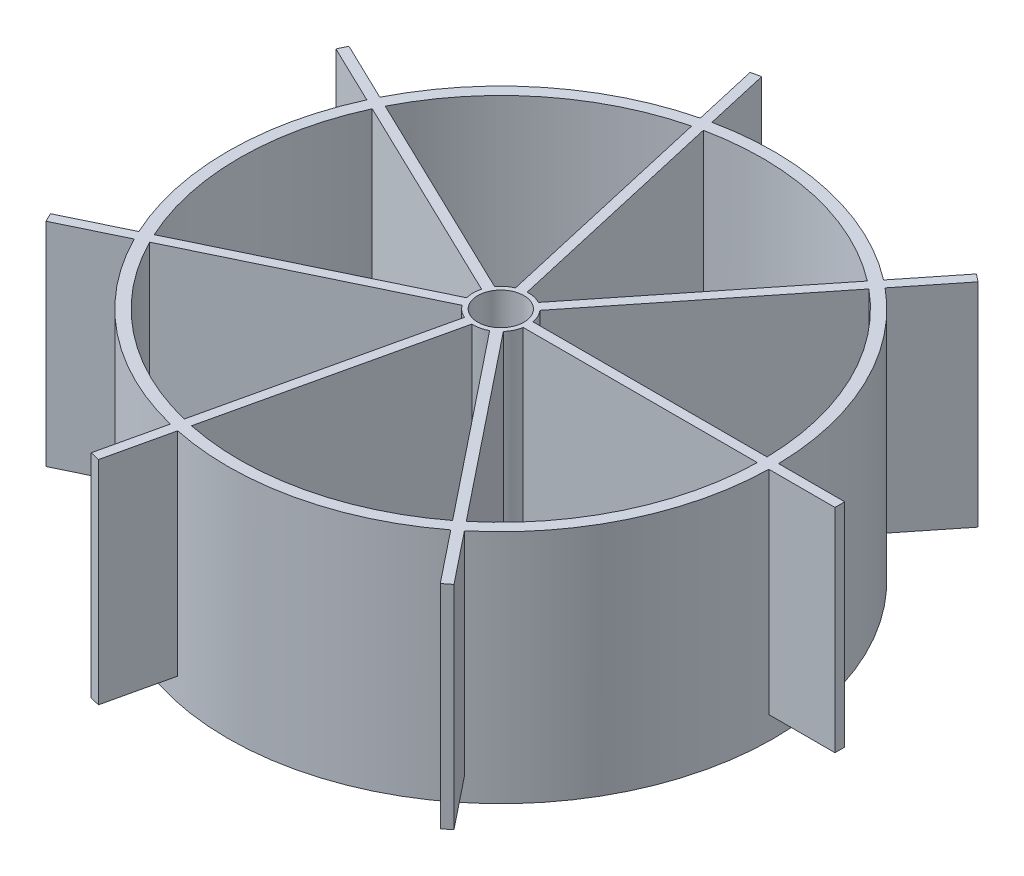
from build123d import *

# Parameters (mm, degrees)
SKETCH1_R           = 113.19870133
BOSS_EXTRUDE1_DEPTH = 10
SKETCH3_R           = 10
BOSS_EXTRUDE2_DEPTH = 92
BOSS_EXTRUDE3_START = -10
SKETCH4_R           = 118.19870133
SKETCH4_R_2         = 113.19870133
BOSS_EXTRUDE3_DEPTH = 102
CUT_EXTRUDE1_START  = -59
CUT_EXTRUDE1_DEPTH  = 59


with BuildPart() as part:
    # Sketch1 → Boss-Extrude1 (new body)
    with BuildSketch(Plane(origin=(0, 0, 0), x_dir=(1, 0, 0), z_dir=(0, 1, 0))):
        with Locations(Location((0, 0, 0), (0, 0, 270))):
            Circle(SKETCH1_R)
    extrude(amount=BOSS_EXTRUDE1_DEPTH)

    # Sketch3 → Boss-Extrude2 (add)
    with BuildSketch(Plane(origin=(0, 10, 0), x_dir=(1, 0, 0), z_dir=(0, 1, 0))):
        with BuildLine():
            Line((11.81310243, 2.10964712), (146.802984355, 2.10964712))
            ThreePointArc((146.802984355, 2.10964712), (146.818142021, 0), (146.802984355, -2.10964712))
            Line((146.802984355, -2.10964712), (11.81310243, -2.10964712))
            ThreePointArc((11.81310243, -2.10964712), (10.811626415, -5.206604869), (9.014737429, -7.920511921))
            Line((9.014737429, -7.920511921), (93.179552163, -113.459851424))
            ThreePointArc((93.179552163, -113.459851424), (91.539614278, -114.78704563), (89.880775093, -116.090538354))
            Line((89.880775093, -116.090538354), (5.715960358, -10.55119885))
            ThreePointArc((5.715960358, -10.55119885), (2.670251207, -11.699134946), (-0.571908724, -11.986363936))
            Line((-0.571908724, -11.986363936), (-30.609983324, -143.591767687))
            ThreePointArc((-30.609983324, -143.591767687), (-32.670110084, -143.137104671), (-34.723491048, -142.652886392))
            Line((-34.723491048, -142.652886392), (-4.685416448, -11.047482641))
            ThreePointArc((-4.685416448, -11.047482641), (-7.481877622, -9.38197779), (-9.727895943, -7.02623943))
            Line((-9.727895943, -7.02623943), (-131.349577039, -65.596154143))
            ThreePointArc((-131.349577039, -65.596154143), (-132.278575204, -63.70200443), (-133.1802602, -61.794701388))
            Line((-133.1802602, -61.794701388), (-11.558579104, -3.224786676))
            ThreePointArc((-11.558579104, -3.224786676), (-12, 0), (-11.558579104, 3.224786676))
            Line((-11.558579104, 3.224786676), (-133.1802602, 61.794701388))
            ThreePointArc((-133.1802602, 61.794701388), (-132.278575204, 63.70200443), (-131.349577039, 65.596154143))
            Line((-131.349577039, 65.596154143), (-9.727895943, 7.02623943))
            ThreePointArc((-9.727895943, 7.02623943), (-7.481877622, 9.38197779), (-4.685416448, 11.047482641))
            Line((-4.685416448, 11.047482641), (-34.723491048, 142.652886392))
            ThreePointArc((-34.723491048, 142.652886392), (-32.670110084, 143.137104671), (-30.609983324, 143.591767687))
            Line((-30.609983324, 143.591767687), (-0.571908724, 11.986363936))
            ThreePointArc((-0.571908724, 11.986363936), (2.670251207, 11.699134946), (5.715960358, 10.55119885))
            Line((5.715960358, 10.55119885), (89.880775093, 116.090538354))
            ThreePointArc((89.880775093, 116.090538354), (91.539614278, 114.78704563), (93.179552163, 113.459851424))
            Line((93.179552163, 113.459851424), (9.014737429, 7.920511921))
            ThreePointArc((9.014737429, 7.920511921), (10.811626415, 5.206604869), (11.81310243, 2.10964712))
        make_face()
        with Locations(Location((0, 0, 0), (0, 0, 270))):
            Circle(SKETCH3_R, mode=Mode.SUBTRACT)
    extrude(amount=BOSS_EXTRUDE2_DEPTH)

    # Sketch4 → Boss-Extrude3 (add)
    with BuildSketch(Plane(origin=(0, 10, 0), x_dir=(1, 0, 0), z_dir=(0, 1, 0)).offset(BOSS_EXTRUDE3_START)):
        with Locations(Location((0, 0, 0), (0, 0, 270))):
            Circle(SKETCH4_R)
        Circle(SKETCH4_R_2, mode=Mode.SUBTRACT)
    extrude(amount=BOSS_EXTRUDE3_DEPTH)

    # Sketch5 → Cut-Extrude1 (cut)
    with BuildSketch(Plane(origin=(0, 10, 0), x_dir=(1, 0, 0), z_dir=(0, 1, 0)).offset(CUT_EXTRUDE1_START)):
        with BuildLine():
            Line((-113.173392965, 2.393555442), (-11.53804838, 2.393555442))
            ThreePointArc((-11.53804838, 2.393555442), (-10.204986578, 5.891851748), (-7.841904008, 8.795465286))
            Line((-7.841904008, 8.795465286), (-58.6595763, 96.814255619))
            ThreePointArc((-58.6595763, 96.814255619), (-98.032951027, 56.599350665), (-113.173392965, 2.393555442))
        make_face()
        with BuildLine():
            Line((-54.513816664, 99.207811061), (-3.696144372, 11.189020728))
            ThreePointArc((-3.696144372, 11.189020728), (0, 11.783703496), (3.696144372, 11.189020728))
            Line((3.696144372, 11.189020728), (54.513816664, 99.207811061))
            ThreePointArc((54.513816664, 99.207811061), (0, 113.19870133), (-54.513816664, 99.207811061))
        make_face()
        with BuildLine():
            Line((-58.6595763, -96.814255619), (-7.841904008, -8.795465286))
            ThreePointArc((-7.841904008, -8.795465286), (-10.204986578, -5.891851748), (-11.53804838, -2.393555442))
            Line((-11.53804838, -2.393555442), (-113.173392965, -2.393555442))
            ThreePointArc((-113.173392965, -2.393555442), (-98.032951027, -56.599350665), (-58.6595763, -96.814255619))
        make_face()
        with BuildLine():
            Line((54.513816664, -99.207811061), (3.696144372, -11.189020728))
            ThreePointArc((3.696144372, -11.189020728), (0, -11.783703496), (-3.696144372, -11.189020728))
            Line((-3.696144372, -11.189020728), (-54.513816664, -99.207811061))
            ThreePointArc((-54.513816664, -99.207811061), (0, -113.19870133), (54.513816664, -99.207811061))
        make_face()
        with BuildLine():
            Line((113.173392965, -2.393555442), (11.53804838, -2.393555442))
            ThreePointArc((11.53804838, -2.393555442), (10.204986578, -5.891851748), (7.841904008, -8.795465286))
            Line((7.841904008, -8.795465286), (58.6595763, -96.814255619))
            ThreePointArc((58.6595763, -96.814255619), (98.032951027, -56.599350665), (113.173392965, -2.393555442))
        make_face()
        with BuildLine():
            Line((58.6595763, 96.814255619), (7.841904008, 8.795465286))
            ThreePointArc((7.841904008, 8.795465286), (10.204986578, 5.891851748), (11.53804838, 2.393555442))
            Line((11.53804838, 2.393555442), (113.173392965, 2.393555442))
            ThreePointArc((113.173392965, 2.393555442), (98.032951027, 56.599350665), (58.6595763, 96.814255619))
        make_face()
    extrude(amount=CUT_EXTRUDE1_DEPTH, mode=Mode.SUBTRACT)


solid = part.part
